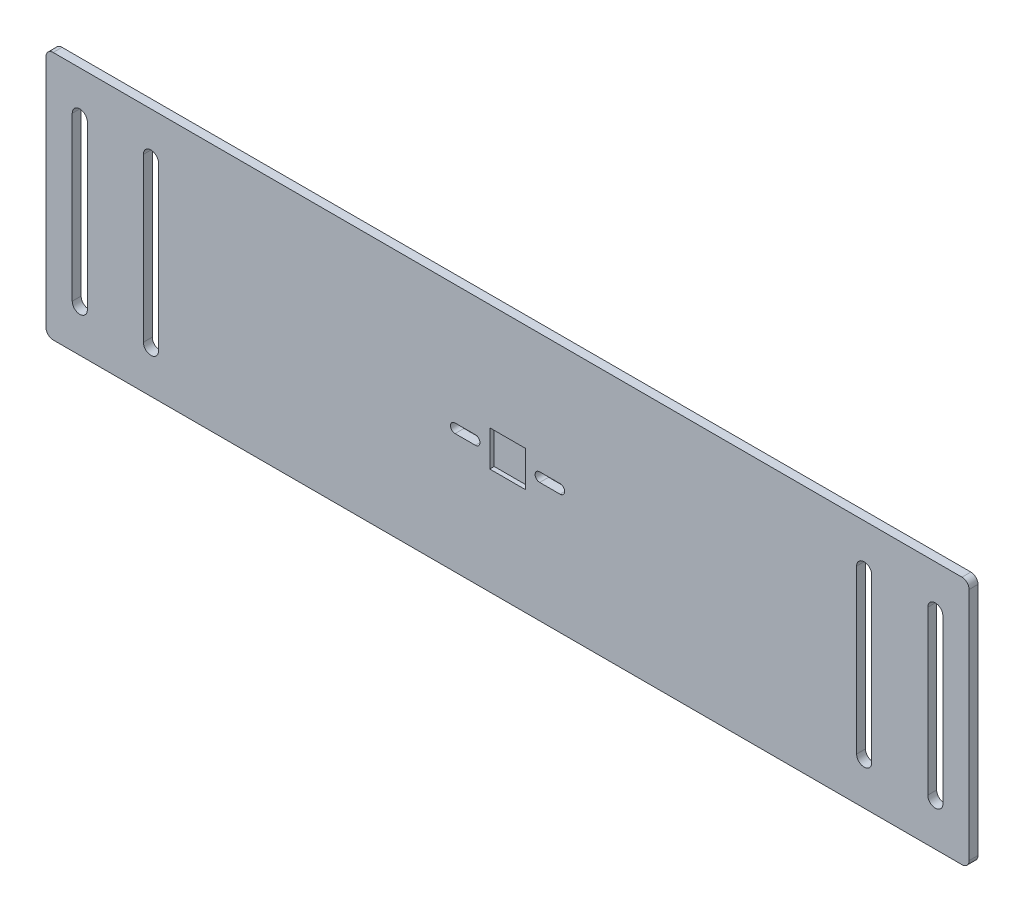
from build123d import *

# Parameters (mm, degrees)
SKETCH2_W           = 465.25
SKETCH2_H           = 140
SKETCH2_W_2         = 29.5
BOSS_EXTRUDE3_DEPTH = 5
FILLET1_R           = 4
SKETCH5_W           = 20.1
SKETCH5_H           = 20.1
CUT_EXTRUDE1_DEPTH  = 2.5
CUT_EXTRUDE2_DEPTH  = 10


with BuildPart() as part:
    # Sketch2 → Boss-Extrude3 (new body)
    # profile 1 of 3: a face of its own
    with BuildSketch(Plane.XY.offset(-537.770775127)):
        with Locations((-247.493842126, 630)):
            Rectangle(SKETCH2_W, SKETCH2_H)
        with BuildLine():
            Line((-456.868842126, 675.75), (-456.868842126, 584.25))
            ThreePointArc((-456.868842126, 584.25), (-461.118842126, 580), (-465.368842126, 584.25))
            Line((-465.368842126, 584.25), (-465.368842126, 675.75))
            ThreePointArc((-465.368842126, 675.75), (-461.118842126, 680), (-456.868842126, 675.75))
        make_face(mode=Mode.SUBTRACT)
        with BuildLine():
            ThreePointArc((-416.868842126, 584.25), (-421.118842126, 580), (-425.368842126, 584.25))
            Line((-425.368842126, 584.25), (-425.368842126, 675.75))
            ThreePointArc((-425.368842126, 675.75), (-421.118842126, 680), (-416.868842126, 675.75))
            Line((-416.868842126, 675.75), (-416.868842126, 584.25))
        make_face(mode=Mode.SUBTRACT)
        with BuildLine():
            Line((-15.868842127, 675.75), (-15.868842127, 584.25))
            ThreePointArc((-15.868842127, 584.25), (-20.118842127, 580), (-24.368842127, 584.25))
            Line((-24.368842127, 584.25), (-24.368842127, 675.75))
            ThreePointArc((-24.368842127, 675.75), (-20.118842127, 680), (-15.868842127, 675.75))
        make_face(mode=Mode.SUBTRACT)
    # profile 2 of 3: a face of its own
    with BuildSketch(Plane.XY.offset(-537.770775127)):
        with Locations((-0.118842126, 630)):
            Rectangle(SKETCH2_W_2, SKETCH2_H)
    # profile 3 of 3: a face of its own
    with BuildSketch(Plane.XY.offset(-537.770775127)):
        Polygon((15.631157874, 700), (14.631157874, 700), (14.631157874, 560), (38.881157874, 560), (38.881157874, 700), (24.131157874, 700), align=None)
        with BuildLine():
            ThreePointArc((24.131157874, 584.25), (19.881157874, 580), (15.631157874, 584.25))
            Line((15.631157874, 584.25), (15.631157874, 675.75))
            ThreePointArc((15.631157874, 675.75), (19.881157874, 680), (24.131157874, 675.75))
            Line((24.131157874, 675.75), (24.131157874, 584.25))
        make_face(mode=Mode.SUBTRACT)
    extrude(amount=BOSS_EXTRUDE3_DEPTH)

    # Fillet1
    fillet1_edges = [part.edges().sort_by_distance(p)[0] for p in [
        (-480.118842126, 700, -535.270775127),
        (38.881157874, 700, -535.270775127),
        (38.881157874, 560, -535.270775127),
        (-480.118842126, 560, -535.270775127),
    ]]
    fillet(fillet1_edges, radius=FILLET1_R)

    # Sketch5 → Cut-Extrude1 (cut)
    with BuildSketch(Plane.XY.offset(-532.770775127)):
        with Locations((-220.568842126, 629.95)):
            Rectangle(SKETCH5_W, SKETCH5_H)
    extrude(amount=-CUT_EXTRUDE1_DEPTH, mode=Mode.SUBTRACT)

    # Sketch6 → Cut-Extrude2 (cut)
    with BuildSketch(Plane.XY.offset(-532.770775127)):
        with BuildLine():
            Line((-191.098842126, 632.575), (-202.552234041, 632.575))
            ThreePointArc((-202.552234041, 632.575), (-205.127234041, 630), (-202.552234041, 627.425))
            Line((-202.552234041, 627.425), (-191.098842126, 627.425))
            ThreePointArc((-191.098842126, 627.425), (-188.523842126, 630), (-191.098842126, 632.575))
        make_face()
        with BuildLine():
            Line((-250.138842126, 627.425), (-238.685450212, 627.425))
            ThreePointArc((-238.685450212, 627.425), (-236.110450212, 630), (-238.685450212, 632.575))
            Line((-238.685450212, 632.575), (-250.138842126, 632.575))
            ThreePointArc((-250.138842126, 632.575), (-252.713842126, 630), (-250.138842126, 627.425))
        make_face()
    extrude(amount=-CUT_EXTRUDE2_DEPTH, mode=Mode.SUBTRACT)


solid = part.part
